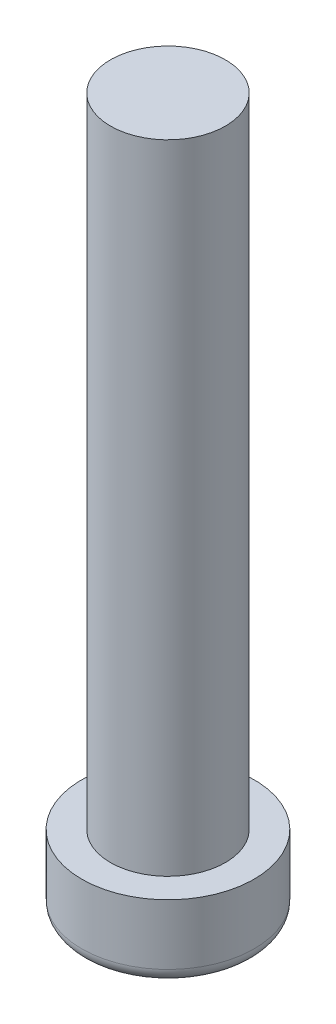
from build123d import *

# Parameters (mm, degrees)
SKETCH_1_R      = 3
EXTRUDE_1_DEPTH = 2.6
SKETCH_2_R      = 2
EXTRUDE_2_DEPTH = 22.2
FILLET_1_R      = 0.5


with BuildPart() as part:
    # 草图1 → 凸台-拉伸1 (new body)
    with BuildSketch(Plane(origin=(0, 0, 0), x_dir=(1, 0, 0), z_dir=(0, 1, 0))):
        with Locations(Location((0, 0, 0), (0, 0, 270))):
            Circle(SKETCH_1_R)
    extrude(amount=EXTRUDE_1_DEPTH)

    # 草图2 → 凸台-拉伸2 (add)
    with BuildSketch(Plane(origin=(0, 2.6, 0), x_dir=(1, 0, 0), z_dir=(0, 1, 0))):
        with Locations(Location((0, 0, 0), (0, 0, 270))):
            Circle(SKETCH_2_R)
    extrude(amount=EXTRUDE_2_DEPTH)

    # 圆角1
    fillet_1_edges = [part.edges().sort_by_distance(p)[0] for p in [
        (0, 0, -3),
    ]]
    fillet(fillet_1_edges, radius=FILLET_1_R)


solid = part.part
